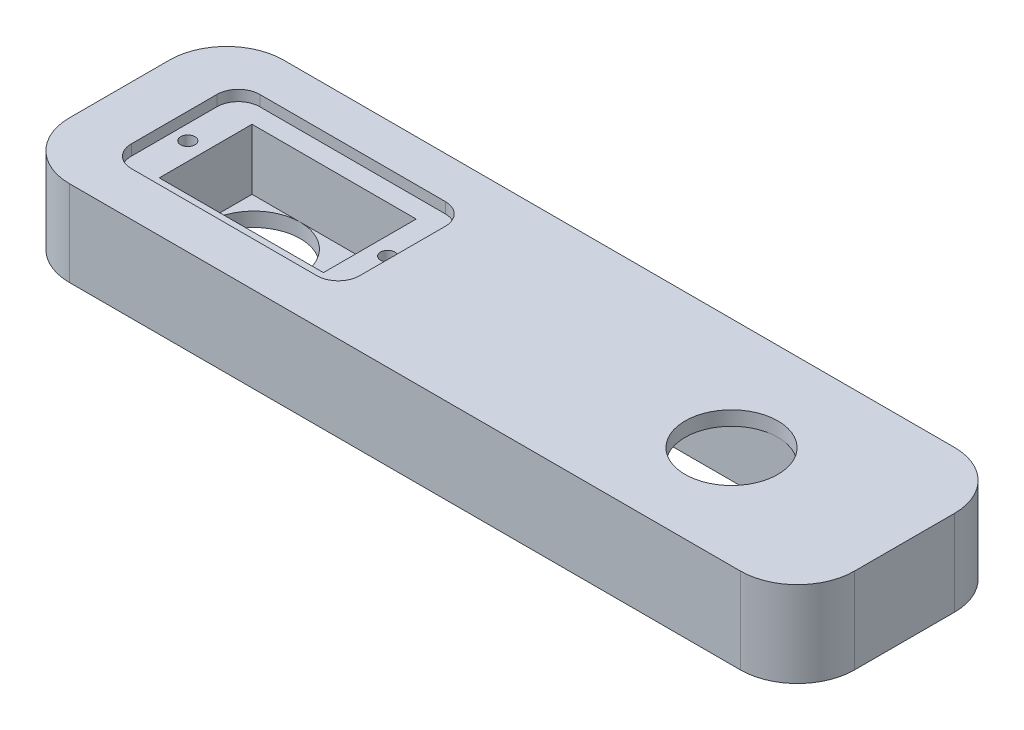
from build123d import *

# Parameters (mm, degrees)
SKETCH1_W           = 110
SKETCH1_H           = 30
BOSS_EXTRUDE1_DEPTH = 12
FILLET2_R           = 8
SKETCH4_R           = 6.5
CUT_EXTRUDE1_DEPTH  = 67.870108383
SKETCH3_W           = 23
SKETCH3_H           = 13
CUT_EXTRUDE2_DEPTH  = 10
SKETCH5_W           = 32
SKETCH5_H           = 18
CUT_EXTRUDE3_DEPTH  = 1.5
FILLET4_R           = 3
SKETCH8_R           = 6.5
CUT_EXTRUDE4_DEPTH  = 63.574437799
SKETCH10_W          = 23
SKETCH10_H          = 13
CUT_EXTRUDE5_DEPTH  = 10
SKETCH12_W          = 32
SKETCH12_H          = 18
CUT_EXTRUDE6_DEPTH  = 1.5
FILLET5_R           = 3
SKETCH14_R          = 1
CUT_EXTRUDE7_DEPTH  = 4
SKETCH6_R           = 1
CUT_EXTRUDE8_DEPTH  = 5


with BuildPart() as part:
    # Sketch1 → Boss-Extrude1 (new body)
    with BuildSketch(Plane(origin=(0, 0, 0), x_dir=(1, 0, 0), z_dir=(0, 1, 0))):
        with Locations((8.243243243, 3.108108108)):
            Rectangle(SKETCH1_W, SKETCH1_H)
    extrude(amount=BOSS_EXTRUDE1_DEPTH)

    # Fillet2
    fillet2_edges = [part.edges().sort_by_distance(p)[0] for p in [
        (-46.756756757, 6, -18.108108108),
        (63.243243243, 6, -18.108108108),
        (63.243243243, 6, 11.891891892),
        (-46.756756757, 6, 11.891891892),
    ]]
    fillet(fillet2_edges, radius=FILLET2_R)

    # Sketch4 → Cut-Extrude1 (cut, through all)
    with BuildSketch(Plane(origin=(0, 12, 0), x_dir=(1, 0, 0), z_dir=(0, 1, 0))):
        with Locations(Location((-27.929103529, 3.108108108, 0), (0, 0, 270))):
            Circle(SKETCH4_R)
    extrude(amount=-CUT_EXTRUDE1_DEPTH, mode=Mode.SUBTRACT)

    # Sketch3 → Cut-Extrude2 (cut)
    with BuildSketch(Plane(origin=(0, 12, 0), x_dir=(1, 0, 0), z_dir=(0, 1, 0))):
        with Locations((-23.179103529, 3.108108108)):
            Rectangle(SKETCH3_W, SKETCH3_H)
    extrude(amount=-CUT_EXTRUDE2_DEPTH, mode=Mode.SUBTRACT)

    # Sketch5 → Cut-Extrude3 (cut)
    with BuildSketch(Plane(origin=(0, 12, 0), x_dir=(1, 0, 0), z_dir=(0, 1, 0))):
        with Locations((-23.262280593, 3.273133416)):
            Rectangle(SKETCH5_W, SKETCH5_H)
    extrude(amount=-CUT_EXTRUDE3_DEPTH, mode=Mode.SUBTRACT)

    # Fillet4
    fillet4_edges = [part.edges().sort_by_distance(p)[0] for p in [
        (-39.262280593, 11.25, 5.726866584),
        (-39.262280593, 11.25, -12.273133416),
        (-7.262280593, 11.25, -12.273133416),
        (-7.262280593, 11.25, 5.726866584),
    ]]
    fillet(fillet4_edges, radius=FILLET4_R)

    # Sketch8 → Cut-Extrude4 (cut, through all)
    with BuildSketch(Plane(origin=(11.720616789, 0, 0.652410252), x_dir=(-1, 0, 0), z_dir=(0, -1, 0))):
        with Locations(Location((-27.929103529, 3.108108108, 0), (0, 0, 90))):
            Circle(SKETCH8_R)
    extrude(amount=-CUT_EXTRUDE4_DEPTH, mode=Mode.SUBTRACT)

    # Sketch10 → Cut-Extrude5 (cut)
    with BuildSketch(Plane(origin=(11.720616789, 0, 0.652410252), x_dir=(-1, 0, 0), z_dir=(0, -1, 0))):
        with Locations((-23.179103529, 3.108108108)):
            Rectangle(SKETCH10_W, SKETCH10_H)
    extrude(amount=-CUT_EXTRUDE5_DEPTH, mode=Mode.SUBTRACT)

    # Sketch12 → Cut-Extrude6 (cut)
    with BuildSketch(Plane(origin=(11.720616789, 0, 0.652410252), x_dir=(-1, 0, 0), z_dir=(0, -1, 0))):
        with Locations((-23.262280593, 3.273133416)):
            Rectangle(SKETCH12_W, SKETCH12_H)
    extrude(amount=-CUT_EXTRUDE6_DEPTH, mode=Mode.SUBTRACT)

    # Fillet5
    fillet5_edges = [part.edges().sort_by_distance(p)[0] for p in [
        (50.982897382, 0.75, 6.379276835),
        (50.982897382, 0.75, -11.620723165),
        (18.982897382, 0.75, -11.620723165),
        (18.982897382, 0.75, 6.379276835),
    ]]
    fillet(fillet5_edges, radius=FILLET5_R)

    # Sketch14 → Cut-Extrude7 (cut)
    with BuildSketch(Plane(origin=(11.720616789, 1.5, 0.652410252), x_dir=(-1, 0, 0), z_dir=(0, -1, 0))):
        with Locations(Location((-37.179103529, 3.108108108, 0), (0, 0, 90))):
            Circle(SKETCH14_R)
        with Locations(Location((-9.179103529, 3.108108108, 0), (0, 0, 270))):
            Circle(SKETCH14_R)
    extrude(amount=-CUT_EXTRUDE7_DEPTH, mode=Mode.SUBTRACT)

    # Sketch6 → Cut-Extrude8 (cut)
    with BuildSketch(Plane(origin=(0, 10.5, 0), x_dir=(1, 0, 0), z_dir=(0, 1, 0))):
        with Locations(Location((-37.179103529, 3.108108108, 0), (0, 0, 270))):
            Circle(SKETCH6_R)
        with Locations(Location((-9.179103529, 3.108108108, 0), (0, 0, 90))):
            Circle(SKETCH6_R)
    extrude(amount=-CUT_EXTRUDE8_DEPTH, mode=Mode.SUBTRACT)


solid = part.part
